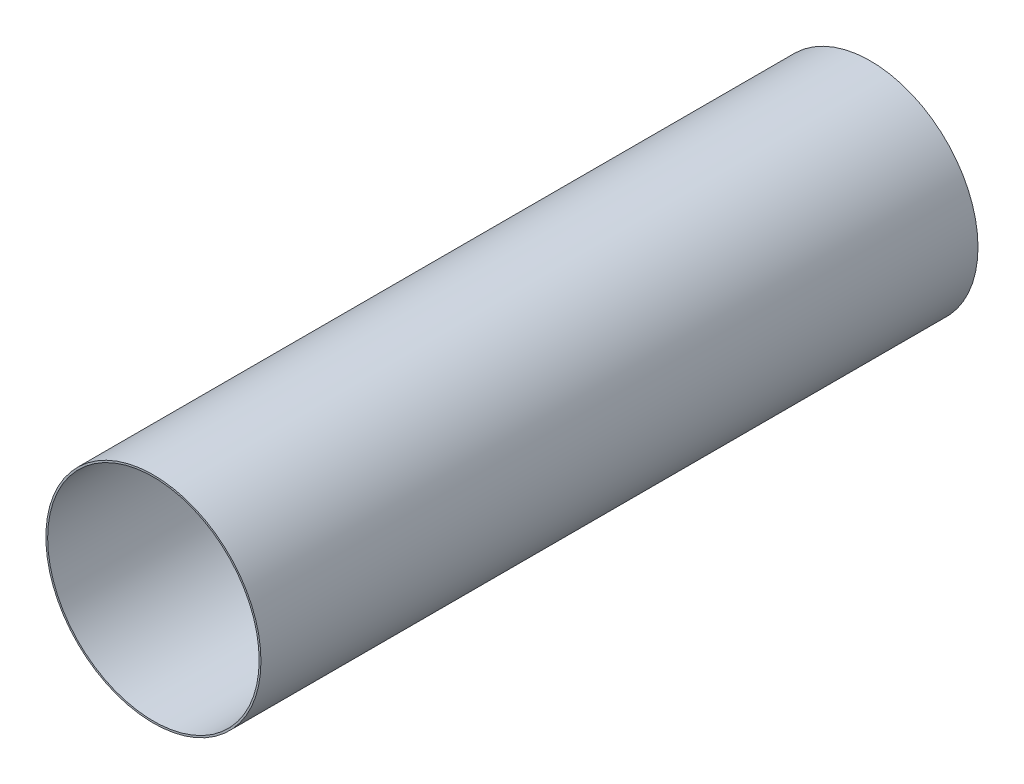
from build123d import *

# Parameters (mm, degrees)
SKETCH1_R           = 30
SKETCH1_R_2         = 29.5
BOSS_EXTRUDE1_DEPTH = 200


with BuildPart() as part:
    # Sketch1 → Boss-Extrude1 (new body)
    with BuildSketch(Plane.XY):
        Circle(SKETCH1_R)
        Circle(SKETCH1_R_2, mode=Mode.SUBTRACT)
    extrude(amount=BOSS_EXTRUDE1_DEPTH)


solid = part.part
